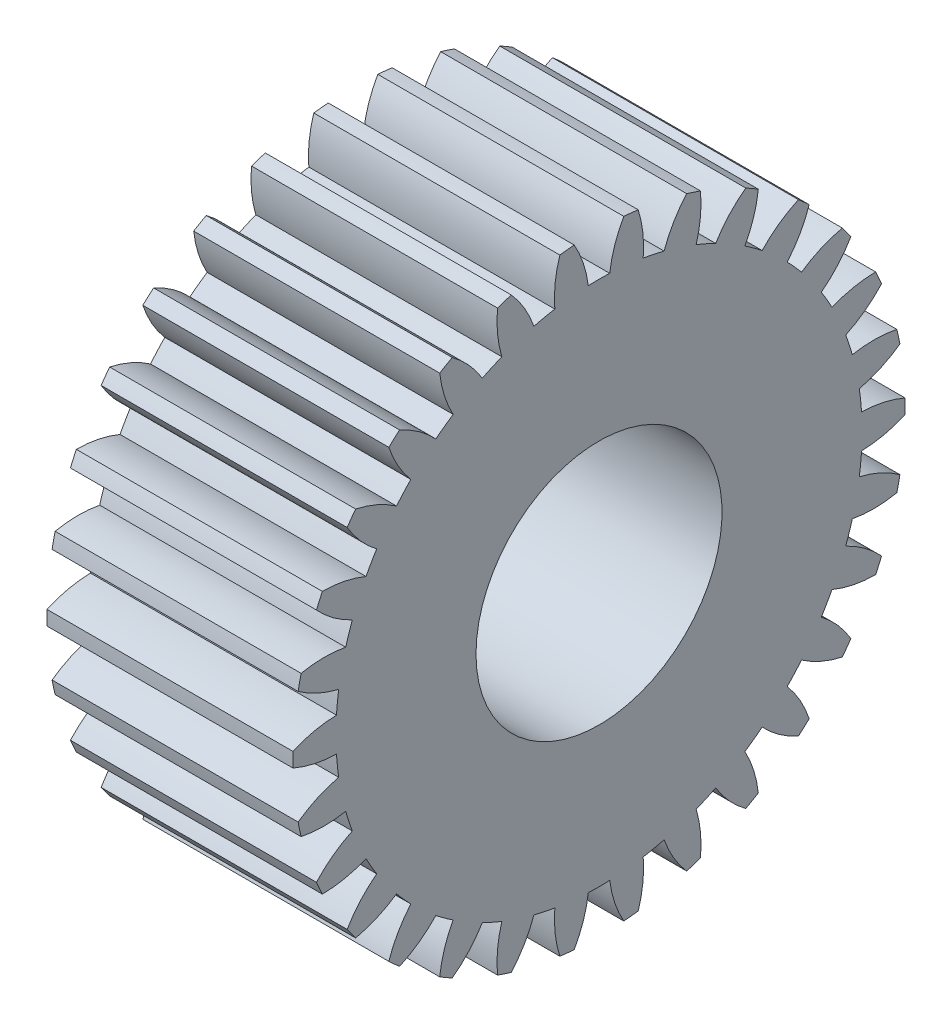
from build123d import *

# Parameters (mm, degrees)
BASPROSKE_W     = 9
BASPROSKE_H     = 11.2
TOOTHCUT_DEPTH  = 19.217573933
TEETHCUTS_COUNT = 30
TEETHCUTS_ANGLE = 348
BORSKE_R        = 4.5
BORE_DEPTH      = 50.0000508


with BuildPart() as part:
    # BasProSke → Base-Revolve (revolve)
    with BuildSketch(Plane(origin=(0, 0, 0), x_dir=(1, 0, 0), z_dir=(0, 1, 0)), mode=Mode.PRIVATE) as base_revolve_sk:
        with Locations((4.5, 5.6)):
            Rectangle(BASPROSKE_W, BASPROSKE_H)
    revolve(base_revolve_sk.sketch.rotate(Axis((-10, 0, 0), (1, 0, 0)), 180), axis=Axis((-10, 0, 0), (1, 0, 0)))

    # TooCutSke → ToothCut (cut, through all)
    with BuildSketch(Plane(origin=(0, 0, 0), x_dir=(0, 0, -1), z_dir=(1, 0, 0))):
        with BuildLine():
            ThreePointArc((0.391311671, 9.616041346), (0, 9.624), (-0.391311671, 9.616041346))
            ThreePointArc((-0.391311671, 9.616041346), (-0.577861565, 10.42820213), (-0.921083332, 11.187547124))
            ThreePointArc((-0.921083332, 11.187547124), (0, 11.2254), (0.921083332, 11.187547124))
            ThreePointArc((0.921083332, 11.187547124), (0.577861565, 10.42820213), (0.391311671, 9.616041346))
        make_face()
    toothcut = extrude(amount=TOOTHCUT_DEPTH, mode=Mode.SUBTRACT)

    # TeethCuts: ToothCut ×30 about axis
    teethcuts_axis = Axis((-10, 0, 0), (1, 0, 0))
    for i in range(1, TEETHCUTS_COUNT):
        add(toothcut.rotate(teethcuts_axis, i * TEETHCUTS_ANGLE / (TEETHCUTS_COUNT - 1)), mode=Mode.SUBTRACT)

    # BorSke → Bore (cut, symmetric)
    with BuildSketch(Plane(origin=(0, 0, 0), x_dir=(0, 0, -1), z_dir=(1, 0, 0))):
        with Locations(Location((0, 0, 0), (0, 0, 180))):
            Circle(BORSKE_R)
    extrude(amount=BORE_DEPTH, both=True, mode=Mode.SUBTRACT)


solid = part.part
